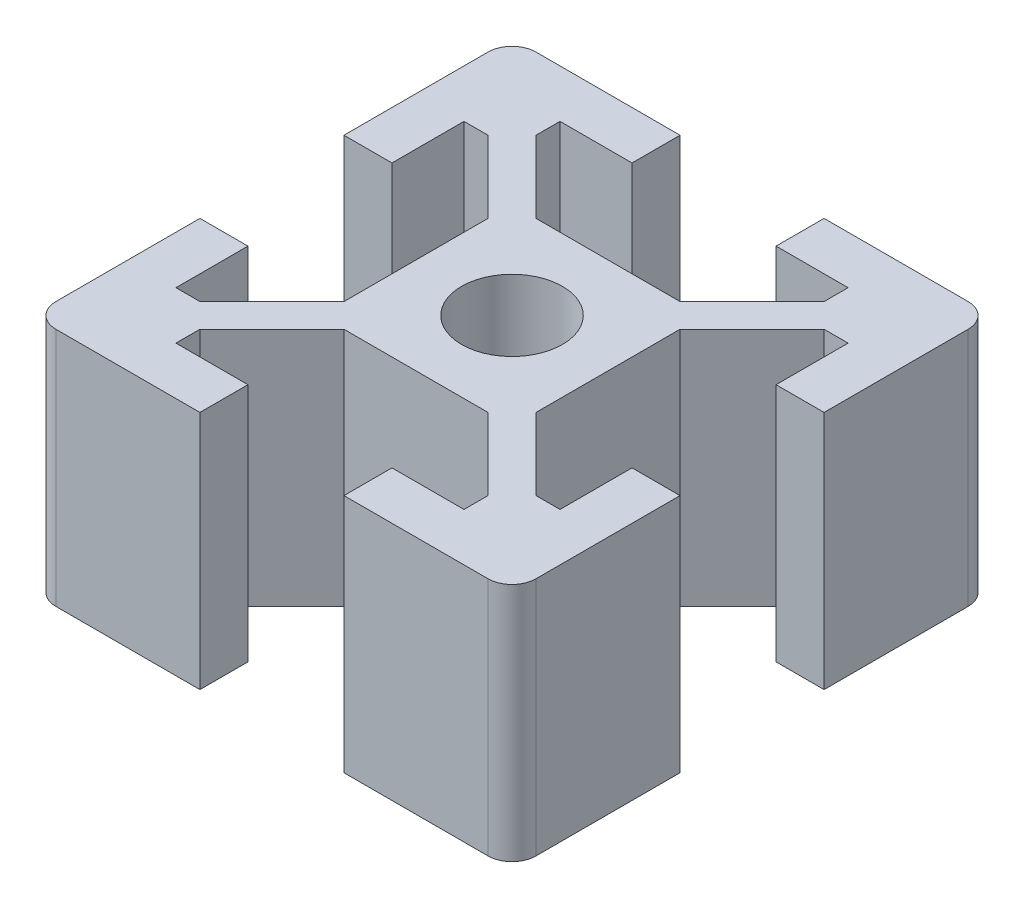
from build123d import *

# Parameters (mm, degrees)
SKETCH1_W           = 8
SKETCH1_H           = 8
SKETCH1_R           = 2.1
BOSS_EXTRUDE1_DEPTH = 10
FILLET1_R           = 1


with BuildPart() as part:
    # Sketch1 → Boss-Extrude1 (new body)
    # profile 1 of 6: a face of its own
    with BuildSketch(Plane(origin=(0, 0, 0), x_dir=(1, 0, 0), z_dir=(0, 1, 0))):
        Polygon((-4, 4), (-10, 10), (-10, 3), (-8, 3), (-8, 6), (-7, 6), (-4, 3), align=None)
    # profile 2 of 6: a face of its own
    with BuildSketch(Plane(origin=(0, 0, 0), x_dir=(1, 0, 0), z_dir=(0, 1, 0))):
        Polygon((-3, 8), (-3, 10), (-10, 10), (-4, 4), (-3, 4), (-6, 7), (-6, 8), align=None)
    # profile 3 of 6: a face of its own
    with BuildSketch(Plane(origin=(0, 0, 0), x_dir=(1, 0, 0), z_dir=(0, 1, 0))):
        Polygon((6, 7), (3, 4), (4, 4), (4, 3), (7, 6), (8, 6), (8, 3), (10, 3), (10, 10), (3, 10), (3, 8), (6, 8), align=None)
    # profile 4 of 6: a face of its own
    with BuildSketch(Plane(origin=(0, 0, 0), x_dir=(1, 0, 0), z_dir=(0, 1, 0))):
        Rectangle(SKETCH1_W, SKETCH1_H)
        with Locations(Location((0, 0, 0), (0, 0, 270))):
            Circle(SKETCH1_R, mode=Mode.SUBTRACT)
    # profile 5 of 6: a face of its own
    with BuildSketch(Plane(origin=(0, 0, 0), x_dir=(1, 0, 0), z_dir=(0, 1, 0))):
        Polygon((4, -4), (3, -4), (6, -7), (6, -8), (3, -8), (3, -10), (10, -10), (10, -3), (8, -3), (8, -6), (7, -6), (4, -3), align=None)
    # profile 6 of 6: a face of its own
    with BuildSketch(Plane(origin=(0, 0, 0), x_dir=(1, 0, 0), z_dir=(0, 1, 0))):
        Polygon((-4, -4), (-4, -3), (-7, -6), (-8, -6), (-8, -3), (-10, -3), (-10, -10), (-3, -10), (-3, -8), (-6, -8), (-6, -7), (-3, -4), align=None)
    extrude(amount=BOSS_EXTRUDE1_DEPTH)

    # Fillet1
    fillet1_edges = [part.edges().sort_by_distance(p)[0] for p in [
        (-10, 5, 10),
        (-10, 5, -10),
        (10, 5, -10),
        (10, 5, 10),
    ]]
    fillet(fillet1_edges, radius=FILLET1_R)


solid = part.part
